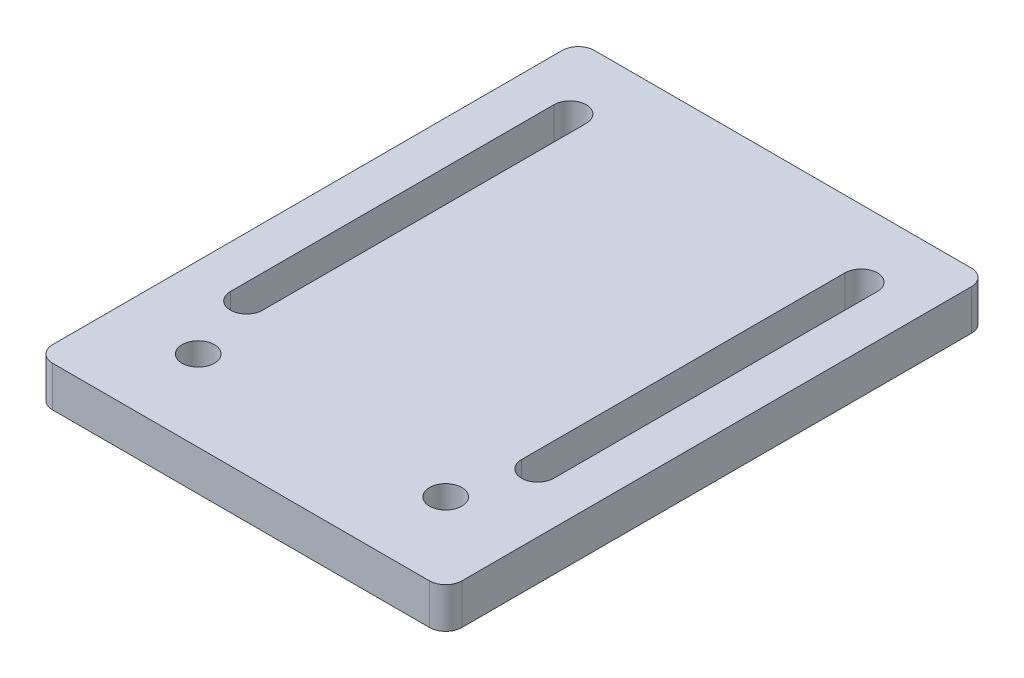
from build123d import *

# Parameters (mm, degrees)
EXTRUDE_1_DEPTH          = 5
FILLET_1_R               = 2
CUT_EXTRUDE_1_DEPTH      = 57.259132592
CUT_EXTRUDE_1_DEPTH_BACK = 57.259132592


with BuildPart() as part:
    # 草图1 → 凸台-拉伸1 (new body)
    with BuildSketch(Plane(origin=(0, 0, 0), x_dir=(1, 0, 0), z_dir=(0, 1, 0))):
        Polygon((25.3, -50), (25.3, 17), (-25.3, 17), (-25.3, -50), (-0.631149451, -50), (0.631149451, -50), align=None)
        with BuildLine():
            ThreePointArc((-13.3, -40), (-15.3, -42), (-17.3, -40))
            ThreePointArc((-17.3, -40), (-15.3, -38), (-13.3, -40))
        make_face(mode=Mode.SUBTRACT)
        with BuildLine():
            ThreePointArc((13.3, -40), (15.3, -38), (17.3, -40))
            ThreePointArc((17.3, -40), (15.3, -42), (13.3, -40))
        make_face(mode=Mode.SUBTRACT)
    extrude(amount=EXTRUDE_1_DEPTH)

    # 圆角1
    fillet_1_edges = [part.edges().sort_by_distance(p)[0] for p in [
        (25.3, 2.5, 50),
        (-25.3, 2.5, 50),
        (-25.3, 2.5, -17),
        (25.3, 2.5, -17),
    ]]
    fillet(fillet_1_edges, radius=FILLET_1_R)

    # 草图2 → 切除-拉伸1 (cut, two sides: drawn at the far end of the back side and taken through both)
    with BuildSketch(Plane(origin=(0, 5, 0), x_dir=(1, 0, 0), z_dir=(0, 1, 0)).offset(-CUT_EXTRUDE_1_DEPTH_BACK)):
        with BuildLine():
            Line((20, 8.678912506), (20, -31.321087494))
            ThreePointArc((20, -31.321087494), (18, -33.321087494), (16, -31.321087494))
            Line((16, -31.321087494), (16, 8.678912506))
            ThreePointArc((16, 8.678912506), (18, 10.678912506), (20, 8.678912506))
        make_face()
        with BuildLine():
            Line((-20, 8.678912506), (-20, -31.321087494))
            ThreePointArc((-20, -31.321087494), (-18, -33.321087494), (-16, -31.321087494))
            Line((-16, -31.321087494), (-16, 8.678912506))
            ThreePointArc((-16, 8.678912506), (-18, 10.678912506), (-20, 8.678912506))
        make_face()
    extrude(amount=CUT_EXTRUDE_1_DEPTH + CUT_EXTRUDE_1_DEPTH_BACK, mode=Mode.SUBTRACT)


solid = part.part
